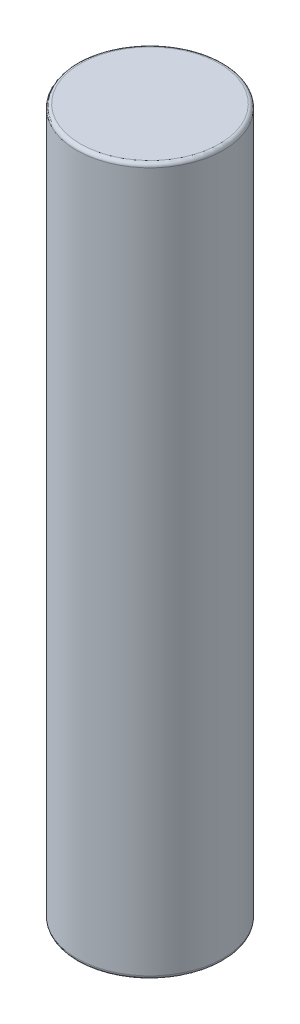
from build123d import *

# Parameters (mm, degrees)
SKETCH1_R           = 2.5
BOSS_EXTRUDE1_DEPTH = 24.13
FILLET1_R           = 0.127


with BuildPart() as part:
    # Sketch1 → Boss-Extrude1 (new body)
    with BuildSketch(Plane(origin=(0, 0, 0), x_dir=(1, 0, 0), z_dir=(0, 1, 0))):
        with Locations(Location((0, 0, 0), (0, 0, 90))):
            Circle(SKETCH1_R)
    extrude(amount=BOSS_EXTRUDE1_DEPTH)

    # Fillet1
    fillet1_edges = [part.edges().sort_by_distance(p)[0] for p in [
        (0, 0, 2.5),
        (0, 24.13, 2.5),
    ]]
    fillet(fillet1_edges, radius=FILLET1_R)


solid = part.part
